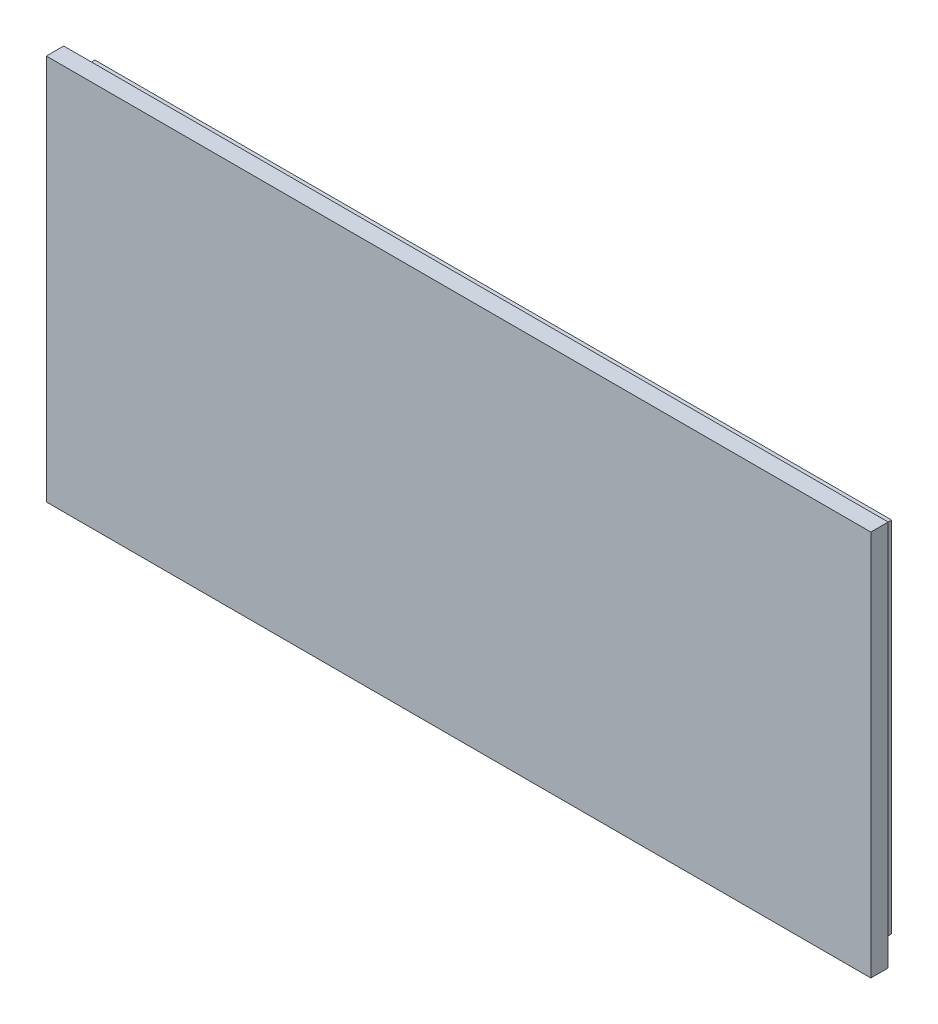
from build123d import *

# Parameters (mm, degrees)
SKETCH1_W           = 190
SKETCH1_H           = 89
BOSS_EXTRUDE1_DEPTH = 4
SKETCH2_W           = 183.6
SKETCH2_H           = 82.6
SKETCH2_W_2         = 179.6
SKETCH2_H_2         = 78.6
BOSS_EXTRUDE2_DEPTH = 4


with BuildPart() as part:
    # Sketch1 → Boss-Extrude1 (new body)
    with BuildSketch(Plane.XY):
        with Locations((-20.5, 3.5)):
            Rectangle(SKETCH1_W, SKETCH1_H)
    extrude(amount=BOSS_EXTRUDE1_DEPTH)

    # Sketch2 → Boss-Extrude2 (add)
    with BuildSketch(Plane(origin=(0, 0, 0), x_dir=(-1, 0, 0), z_dir=(0, 0, -1))):
        with Locations((20.5, 3.5)):
            Rectangle(SKETCH2_W, SKETCH2_H)
        with Locations((20.5, 3.5)):
            Rectangle(SKETCH2_W_2, SKETCH2_H_2, mode=Mode.SUBTRACT)
    extrude(amount=BOSS_EXTRUDE2_DEPTH)


solid = part.part
